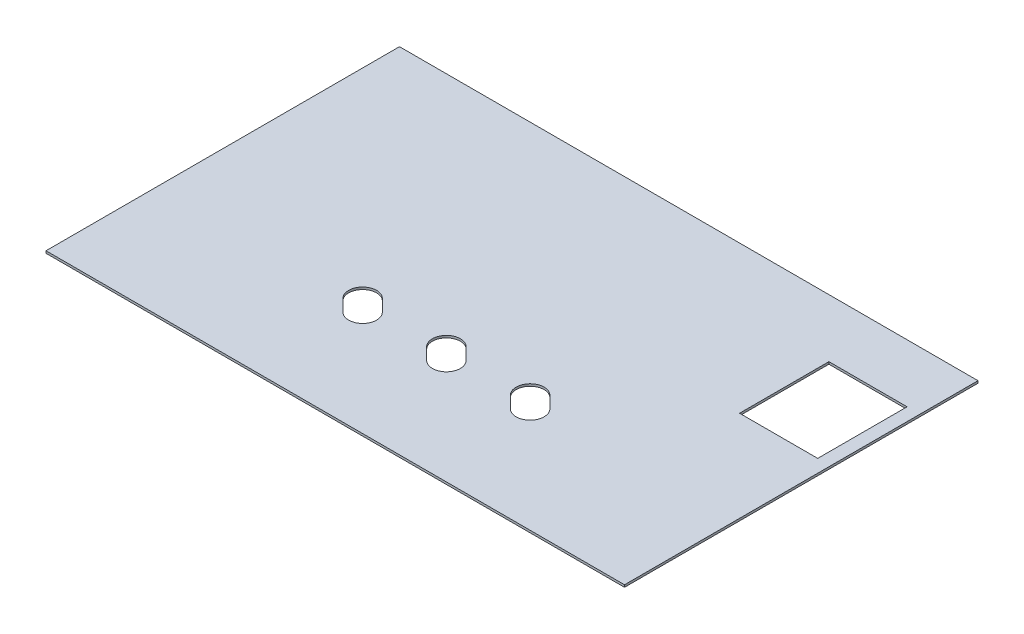
from build123d import *

# Parameters (mm, degrees)
SKETCH1_W           = 103.6
SKETCH1_H           = 63.3
BOSS_EXTRUDE1_DEPTH = 0.4
SKETCH2_W           = 14
SKETCH2_H           = 16
CUT_EXTRUDE1_DEPTH  = 61.705209826
CUT_EXTRUDE2_DEPTH  = 61.705209826
LPATTERN1_COUNT     = 2
LPATTERN1_PITCH     = 15
LPATTERN1_COL_COUNT = 2
LPATTERN1_COL_PITCH = 15


with BuildPart() as part:
    # Sketch1 → Boss-Extrude1 (new body)
    with BuildSketch(Plane(origin=(0, 0, 0), x_dir=(1, 0, 0), z_dir=(0, 1, 0))):
        Rectangle(SKETCH1_W, SKETCH1_H)
    extrude(amount=-BOSS_EXTRUDE1_DEPTH)

    # Sketch2 → Cut-Extrude1 (cut, through all)
    with BuildSketch(Plane(origin=(0, 0, 0), x_dir=(1, 0, 0), z_dir=(0, 1, 0))):
        with Locations((42.5, 13.25)):
            Rectangle(SKETCH2_W, SKETCH2_H)
    extrude(amount=-CUT_EXTRUDE1_DEPTH, mode=Mode.SUBTRACT)

    # Sketch3 → Cut-Extrude2 (cut, through all)
    with BuildSketch(Plane(origin=(0, 0, 0), x_dir=(1, 0, 0), z_dir=(0, 1, 0))):
        with BuildLine():
            Line((0.707106781, -8.921572875), (2.828427125, -11.042893219))
            ThreePointArc((2.828427125, -11.042893219), (2.828427125, -14.578427125), (-0.707106781, -14.578427125))
            Line((-0.707106781, -14.578427125), (-2.828427125, -12.457106781))
            ThreePointArc((-2.828427125, -12.457106781), (-2.828427125, -8.921572875), (0.707106781, -8.921572875))
        make_face()
    cut_extrude2 = extrude(amount=-CUT_EXTRUDE2_DEPTH, mode=Mode.SUBTRACT)

    # LPattern1: Cut-Extrude2 ×2
    with Locations(*[(i * LPATTERN1_PITCH, 0, 0) for i in range(1, LPATTERN1_COUNT)]):
        add(cut_extrude2, mode=Mode.SUBTRACT)

    # LPattern1 col: Cut-Extrude2 ×2
    with Locations(*[(-i * LPATTERN1_COL_PITCH, 0, 0) for i in range(1, LPATTERN1_COL_COUNT)]):
        add(cut_extrude2, mode=Mode.SUBTRACT)


solid = part.part
